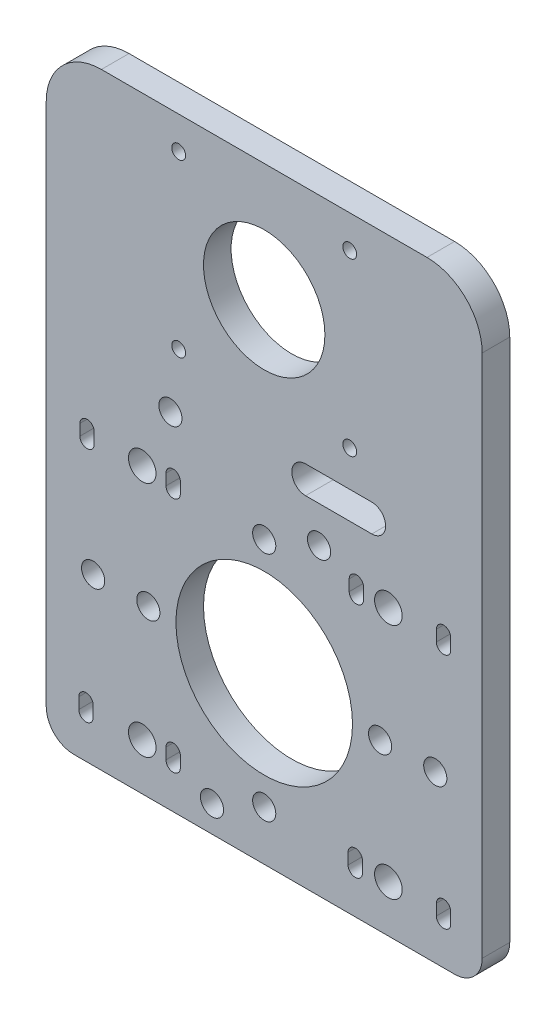
from build123d import *

# Parameters (mm, degrees)
SKETCH1_W           = 79
SKETCH1_H           = 110
SKETCH1_R           = 16
SKETCH1_R_2         = 11
SKETCH1_R_3         = 2.1
SKETCH1_R_4         = 1.25
BOSS_EXTRUDE1_DEPTH = 2.5
SKETCH2_R           = 2.5
CUT_EXTRUDE1_DEPTH  = 648.672345596
FILLET1_R           = 10
FILLET2_R           = 5


with BuildPart() as part:
    # Sketch1 → Boss-Extrude1 (new, symmetric)
    with BuildSketch(Plane.XY):
        Rectangle(SKETCH1_W, SKETCH1_H)
        with Locations((0, -25)):
            Circle(SKETCH1_R, mode=Mode.SUBTRACT)
        with Locations((0, 33.6)):
            Circle(SKETCH1_R_2, mode=Mode.SUBTRACT)
        with Locations((21, -25)):
            Circle(SKETCH1_R_3, mode=Mode.SUBTRACT)
        with Locations((-21, -25)):
            Circle(SKETCH1_R_3, mode=Mode.SUBTRACT)
        with Locations((0, -4)):
            Circle(SKETCH1_R_3, mode=Mode.SUBTRACT)
        with Locations((0, -46)):
            Circle(SKETCH1_R_3, mode=Mode.SUBTRACT)
        with Locations((15.5, 49.1)):
            Circle(SKETCH1_R_4, mode=Mode.SUBTRACT)
        with Locations((15.5, 18.1)):
            Circle(SKETCH1_R_4, mode=Mode.SUBTRACT)
        with Locations((-15.5, 18.1)):
            Circle(SKETCH1_R_4, mode=Mode.SUBTRACT)
        with Locations((-15.5, 49.1)):
            Circle(SKETCH1_R_4, mode=Mode.SUBTRACT)
        with Locations((-17, 7.5)):
            Circle(SKETCH1_R_3, mode=Mode.SUBTRACT)
        with Locations((9.941037343, 0)):
            Circle(SKETCH1_R_3, mode=Mode.SUBTRACT)
        with Locations((31, -25)):
            Circle(SKETCH1_R_3, mode=Mode.SUBTRACT)
        with Locations((-9.466357856, -50.166900153)):
            Circle(SKETCH1_R_3, mode=Mode.SUBTRACT)
        with Locations((-31, -25)):
            Circle(SKETCH1_R_3, mode=Mode.SUBTRACT)
        with BuildLine():
            Line((7.5, 11.6), (19.5, 11.6))
            ThreePointArc((19.5, 11.6), (22, 9.1), (19.5, 6.6))
            Line((19.5, 6.6), (7.5, 6.6))
            ThreePointArc((7.5, 6.6), (5, 9.1), (7.5, 11.6))
        make_face(mode=Mode.SUBTRACT)
    extrude(amount=BOSS_EXTRUDE1_DEPTH, both=True)

    # Sketch2 → Cut-Extrude1 (cut, through all)
    with BuildSketch(Plane(origin=(-158.166263917, -561.751583183, 2.5), x_dir=(1, 0, 0), z_dir=(0, 0, 1))):
        with Locations((136.066263917, 558.251583183)):
            Circle(SKETCH2_R)
        with Locations(Location((180.666263917, 558.251583183, 0), (0, 0, 180))):
            Circle(SKETCH2_R)
        with Locations(Location((136.066263917, 515.251583183, 0), (0, 0, 180))):
            Circle(SKETCH2_R)
        with Locations((180.666263917, 515.251583183)):
            Circle(SKETCH2_R)
        with BuildLine():
            Line((191.966263917, 559.251583183), (191.966263917, 557.251583183))
            ThreePointArc((191.966263917, 557.251583183), (190.666263917, 555.951583183), (189.366263917, 557.251583183))
            Line((189.366263917, 557.251583183), (189.366263917, 559.251583183))
            ThreePointArc((189.366263917, 559.251583183), (190.666263917, 560.551583183), (191.966263917, 559.251583183))
        make_face()
        with BuildLine():
            Line((173.566263917, 557.251583183), (173.566263917, 559.251583183))
            ThreePointArc((173.566263917, 559.251583183), (174.866263917, 560.551583183), (176.166263917, 559.251583183))
            Line((176.166263917, 559.251583183), (176.166263917, 557.251583183))
            ThreePointArc((176.166263917, 557.251583183), (174.866263917, 555.951583183), (173.566263917, 557.251583183))
        make_face()
        with BuildLine():
            Line((142.966263917, 557.251583183), (142.966263917, 559.251583183))
            ThreePointArc((142.966263917, 559.251583183), (141.666263917, 560.551583183), (140.366263917, 559.251583183))
            Line((140.366263917, 559.251583183), (140.366263917, 557.251583183))
            ThreePointArc((140.366263917, 557.251583183), (141.666263917, 555.951583183), (142.966263917, 557.251583183))
        make_face()
        with BuildLine():
            Line((124.766263917, 559.251583183), (124.766263917, 557.251583183))
            ThreePointArc((124.766263917, 557.251583183), (126.066263917, 555.951583183), (127.366263917, 557.251583183))
            Line((127.366263917, 557.251583183), (127.366263917, 559.251583183))
            ThreePointArc((127.366263917, 559.251583183), (126.066263917, 560.551583183), (124.766263917, 559.251583183))
        make_face()
        with BuildLine():
            Line((124.566263917, 514.251583183), (124.566263917, 516.251583183))
            ThreePointArc((124.566263917, 516.251583183), (125.866263917, 517.551583183), (127.166263917, 516.251583183))
            Line((127.166263917, 516.251583183), (127.166263917, 514.251583183))
            ThreePointArc((127.166263917, 514.251583183), (125.866263917, 512.951583183), (124.566263917, 514.251583183))
        make_face()
        with BuildLine():
            Line((142.966263917, 516.251583183), (142.966263917, 514.251583183))
            ThreePointArc((142.966263917, 514.251583183), (141.666263917, 512.951583183), (140.366263917, 514.251583183))
            Line((140.366263917, 514.251583183), (140.366263917, 516.251583183))
            ThreePointArc((140.366263917, 516.251583183), (141.666263917, 517.551583183), (142.966263917, 516.251583183))
        make_face()
        with BuildLine():
            Line((173.366263917, 516.251583183), (173.366263917, 514.251583183))
            ThreePointArc((173.366263917, 514.251583183), (174.666263917, 512.951583183), (175.966263917, 514.251583183))
            Line((175.966263917, 514.251583183), (175.966263917, 516.251583183))
            ThreePointArc((175.966263917, 516.251583183), (174.666263917, 517.551583183), (173.366263917, 516.251583183))
        make_face()
        with BuildLine():
            Line((191.966263917, 514.251583183), (191.966263917, 516.251583183))
            ThreePointArc((191.966263917, 516.251583183), (190.666263917, 517.551583183), (189.366263917, 516.251583183))
            Line((189.366263917, 516.251583183), (189.366263917, 514.251583183))
            ThreePointArc((189.366263917, 514.251583183), (190.666263917, 512.951583183), (191.966263917, 514.251583183))
        make_face()
    extrude(amount=-CUT_EXTRUDE1_DEPTH, mode=Mode.SUBTRACT)

    # Fillet1
    fillet1_edges = [part.edges().sort_by_distance(p)[0] for p in [
        (-39.5, 55, 0),
        (39.5, 55, 0),
    ]]
    fillet(fillet1_edges, radius=FILLET1_R)

    # Fillet2
    fillet2_edges = [part.edges().sort_by_distance(p)[0] for p in [
        (39.5, -55, 0),
        (-39.5, -55, 0),
    ]]
    fillet(fillet2_edges, radius=FILLET2_R)


solid = part.part
